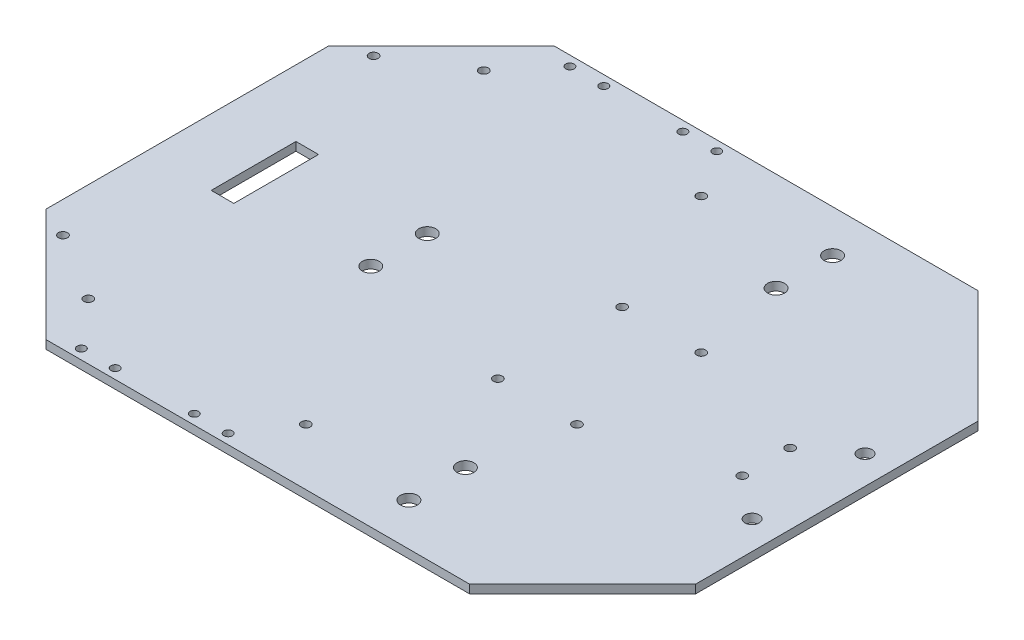
from build123d import *

# Parameters (mm, degrees)
SKETCH3_R                      = 1.6
SKETCH3_R_2                    = 3
BOSS_EXTRUDE1_DEPTH            = 3
F_3_0MM_DOWEL_HOLE1_AT_2_COUNT = 2
F_3_0MM_DOWEL_HOLE1_AT_2_PITCH = 28
F_5_0MM_DOWEL_HOLE1_D          = 5
F_5_0MM_DOWEL_HOLE1_DEPTH      = 5
F_5_0MM_DOWEL_HOLE1_TIP        = 1.502151548
SKETCH12_R                     = 1.5
CUT_EXTRUDE1_DEPTH             = 151.029997001
SKETCH13_W                     = 8
SKETCH13_H                     = 30
CUT_EXTRUDE2_DEPTH             = 3


with BuildPart() as part:
    # Sketch3 → Boss-Extrude1 (new body)
    with BuildSketch(Plane(origin=(0, 0, 0), x_dir=(1, 0, 0), z_dir=(0, 1, 0))):
        Polygon((-70, 90), (80, 90), (120, 50), (120, -50), (80, -90), (-70, -90), (-110, -50), (-110, 50), align=None)
        with Locations(Location((-99, 55, 0), (0, 0, 90))):
            Circle(SKETCH3_R, mode=Mode.SUBTRACT)
        with Locations(Location((-99, -55, 0), (0, 0, 270))):
            Circle(SKETCH3_R, mode=Mode.SUBTRACT)
        with Locations(Location((43.5, -55, 0), (0, 0, 270))):
            Circle(SKETCH3_R_2, mode=Mode.SUBTRACT)
        with Locations(Location((43.5, -75, 0), (0, 0, 270))):
            Circle(SKETCH3_R_2, mode=Mode.SUBTRACT)
        with Locations(Location((43.5, 75, 0), (0, 0, 90))):
            Circle(SKETCH3_R_2, mode=Mode.SUBTRACT)
        with Locations(Location((43.5, 55, 0), (0, 0, 90))):
            Circle(SKETCH3_R_2, mode=Mode.SUBTRACT)
        with Locations(Location((-35, 10, 0), (0, 0, 270))):
            Circle(SKETCH3_R_2, mode=Mode.SUBTRACT)
        with Locations(Location((-35, -10, 0), (0, 0, 90))):
            Circle(SKETCH3_R_2, mode=Mode.SUBTRACT)
        with Locations(Location((50, -22, 0), (0, 0, 270))):
            Circle(SKETCH3_R, mode=Mode.SUBTRACT)
        with Locations(Location((95, -8.5, 0), (0, 0, 270))):
            Circle(SKETCH3_R, mode=Mode.SUBTRACT)
        with Locations(Location((22, 22, 0), (0, 0, 270))):
            Circle(SKETCH3_R, mode=Mode.SUBTRACT)
        with Locations(Location((50, 22, 0), (0, 0, 270))):
            Circle(SKETCH3_R, mode=Mode.SUBTRACT)
        with Locations(Location((95, 8.5, 0), (0, 0, 90))):
            Circle(SKETCH3_R, mode=Mode.SUBTRACT)
        with Locations(Location((22, -22, 0), (0, 0, 270))):
            Circle(SKETCH3_R, mode=Mode.SUBTRACT)
        with Locations(Location((-75, -70, 0), (0, 0, 270))):
            Circle(SKETCH3_R, mode=Mode.SUBTRACT)
        with Locations(Location((2, -70, 0), (0, 0, 270))):
            Circle(SKETCH3_R, mode=Mode.SUBTRACT)
        with Locations(Location((2, 70, 0), (0, 0, 90))):
            Circle(SKETCH3_R, mode=Mode.SUBTRACT)
        with Locations(Location((-75, 70, 0), (0, 0, 90))):
            Circle(SKETCH3_R, mode=Mode.SUBTRACT)
    extrude(amount=BOSS_EXTRUDE1_DEPTH)

    # Sketch9 → Ø3.0mm Dowel Hole1 (revolve, cut)
    with BuildSketch(Plane(origin=(-21, 0, -86.5), x_dir=(0, 0, -1), z_dir=(1, 0, 0))):
        Polygon((0, 0), (0, 5.901290929), (1.5, 5), (1.5, 0), align=None)
    f_3_0mm_dowel_hole1 = revolve(axis=Axis((-21, -6.35, -86.5), (0, 1, 0)), mode=Mode.SUBTRACT)

    # Ø3.0mm Dowel Hole1 at 2: Ø3.0mm Dowel Hole1 ×2
    with Locations(*[(-i * F_3_0MM_DOWEL_HOLE1_AT_2_PITCH, 0, 0) for i in range(1, F_3_0MM_DOWEL_HOLE1_AT_2_COUNT)]):
        add(f_3_0mm_dowel_hole1, mode=Mode.SUBTRACT)

    # Mirror3: Ø3.0mm Dowel Hole1 across plane
    add(f_3_0mm_dowel_hole1.mirror(Plane.XY), mode=Mode.SUBTRACT)

    # Mirror3 copy 1 sketch → Mirror3 copy 1 (revolve, cut)
    with BuildSketch(Plane(origin=(-49, 0, 86.5), x_dir=(0, 0, 1), z_dir=(1, 0, 0))):
        Polygon((0, 0), (0, -5.901290929), (1.5, -5), (1.5, 0), align=None)
    revolve(axis=Axis((-49, -6.35, 86.5), (0, -1, 0)), mode=Mode.SUBTRACT)

    # Ø5.0mm Dowel Hole1
    with Locations(Plane(origin=(110, 0, -20), x_dir=(0, 0, -1), z_dir=(0, -1, 0))):
        with Locations((0, 0), (-40, 0)):
            Hole(F_5_0MM_DOWEL_HOLE1_D / 2, depth=F_5_0MM_DOWEL_HOLE1_DEPTH)
            with Locations((0, 0, -(F_5_0MM_DOWEL_HOLE1_DEPTH + F_5_0MM_DOWEL_HOLE1_TIP / 2))):  # 118° drill point
                Cone(0, F_5_0MM_DOWEL_HOLE1_D / 2, F_5_0MM_DOWEL_HOLE1_TIP, mode=Mode.SUBTRACT)

    # Sketch12 → Cut-Extrude1 (cut, through all)
    with BuildSketch(Plane(origin=(0, 3, 0), x_dir=(1, 0, 0), z_dir=(0, 1, 0))):
        with Locations(Location((-61, -86.5, 0), (0, 0, 270))):
            Circle(SKETCH12_R)
        with Locations(Location((-9, -86.5, 0), (0, 0, 270))):
            Circle(SKETCH12_R)
        with Locations(Location((-61, 86.5, 0), (0, 0, 90))):
            Circle(SKETCH12_R)
        with Locations(Location((-9, 86.5, 0), (0, 0, 90))):
            Circle(SKETCH12_R)
    extrude(amount=-CUT_EXTRUDE1_DEPTH, mode=Mode.SUBTRACT)

    # Sketch13 → Cut-Extrude2 (cut)
    with BuildSketch(Plane(origin=(0, 0, 0), x_dir=(-1, 0, 0), z_dir=(0, -1, 0))):
        with Locations((82.5, 0)):
            Rectangle(SKETCH13_W, SKETCH13_H)
    extrude(amount=-CUT_EXTRUDE2_DEPTH, mode=Mode.SUBTRACT)


solid = part.part
